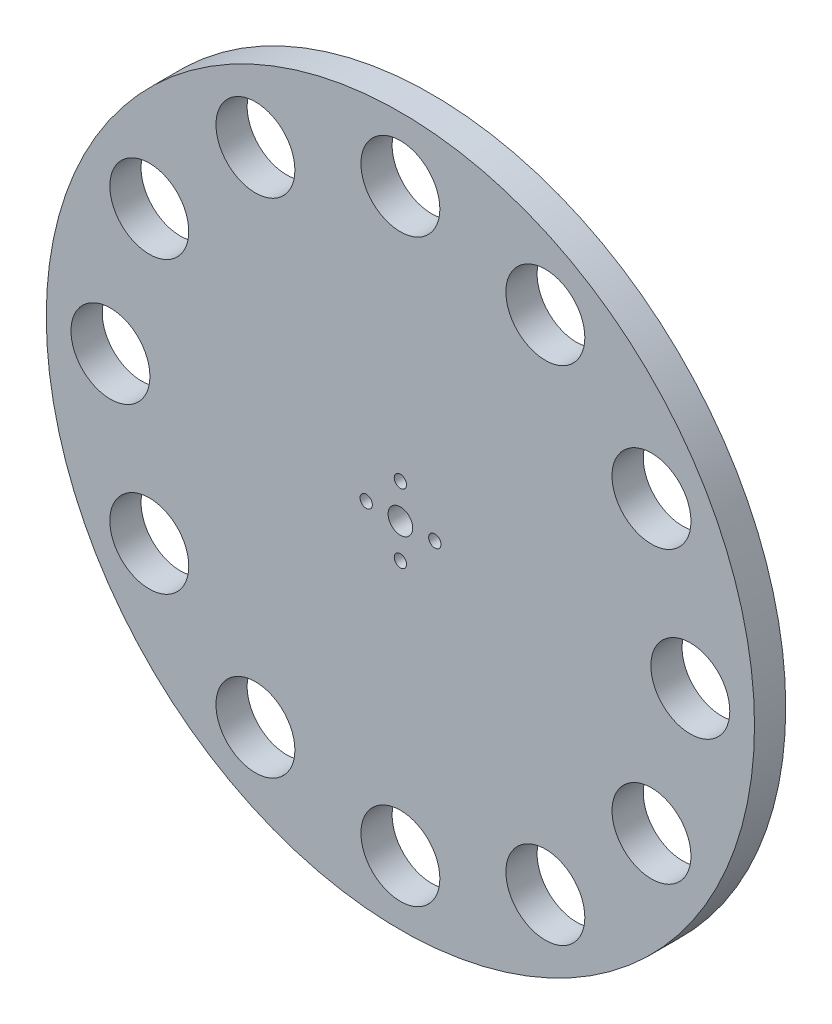
from build123d import *

# Parameters (mm, degrees)
SKETCH1_R             = 72
SKETCH1_R_2           = 8.025
BOSS_EXTRUDE1_DEPTH   = 6.35
SKETCH2_R             = 2.5
CUT_EXTRUDE1_DEPTH    = 10
M3X0_5_TAPPED_HOLE1_D = 2.5
M3X0_5_TAPPED_HOLE2_D = 2.5
M3X0_5_TAPPED_HOLE3_D = 2.5
M3X0_5_TAPPED_HOLE4_D = 2.5


with BuildPart() as part:
    # Sketch1 → Boss-Extrude1 (new body)
    with BuildSketch(Plane.XY):
        Circle(SKETCH1_R)
        with Locations((58.95, 0)):
            Circle(SKETCH1_R_2, mode=Mode.SUBTRACT)
        with Locations((51.052197553, 29.475)):
            Circle(SKETCH1_R_2, mode=Mode.SUBTRACT)
        with Locations((29.475, 51.052197553)):
            Circle(SKETCH1_R_2, mode=Mode.SUBTRACT)
        with Locations((0, 58.95)):
            Circle(SKETCH1_R_2, mode=Mode.SUBTRACT)
        with Locations((-29.475, 51.052197553)):
            Circle(SKETCH1_R_2, mode=Mode.SUBTRACT)
        with Locations((-51.052197553, 29.475)):
            Circle(SKETCH1_R_2, mode=Mode.SUBTRACT)
        with Locations((-58.95, 0)):
            Circle(SKETCH1_R_2, mode=Mode.SUBTRACT)
        with Locations((-51.052197553, -29.475)):
            Circle(SKETCH1_R_2, mode=Mode.SUBTRACT)
        with Locations((-29.475, -51.052197553)):
            Circle(SKETCH1_R_2, mode=Mode.SUBTRACT)
        with Locations((0, -58.95)):
            Circle(SKETCH1_R_2, mode=Mode.SUBTRACT)
        with Locations((29.475, -51.052197553)):
            Circle(SKETCH1_R_2, mode=Mode.SUBTRACT)
        with Locations((51.052197553, -29.475)):
            Circle(SKETCH1_R_2, mode=Mode.SUBTRACT)
    extrude(amount=BOSS_EXTRUDE1_DEPTH)

    # Sketch2 → Cut-Extrude1 (cut)
    with BuildSketch(Plane.XY.offset(6.35)):
        Circle(SKETCH2_R)
    extrude(amount=-CUT_EXTRUDE1_DEPTH, mode=Mode.SUBTRACT)

    # M3x0.5 Tapped Hole1 (through all)
    with Locations(Plane(origin=(-6.94699298, 0, 6.35), x_dir=(1, 0, 0), z_dir=(0, 0, 1))):
        with Locations((0, 0)):
            Hole(M3X0_5_TAPPED_HOLE1_D / 2)

    # M3x0.5 Tapped Hole2 (through all)
    with Locations(Plane(origin=(0, 7, 6.35), x_dir=(1, 0, 0), z_dir=(0, 0, 1))):
        with Locations((0, 0)):
            Hole(M3X0_5_TAPPED_HOLE2_D / 2)

    # M3x0.5 Tapped Hole3 (through all)
    with Locations(Plane(origin=(0, -7, 6.35), x_dir=(1, 0, 0), z_dir=(0, 0, 1))):
        with Locations((0, 0)):
            Hole(M3X0_5_TAPPED_HOLE3_D / 2)

    # M3x0.5 Tapped Hole4 (through all)
    with Locations(Plane(origin=(7, 0, 6.35), x_dir=(1, 0, 0), z_dir=(0, 0, 1))):
        with Locations((0, 0)):
            Hole(M3X0_5_TAPPED_HOLE4_D / 2)


solid = part.part
